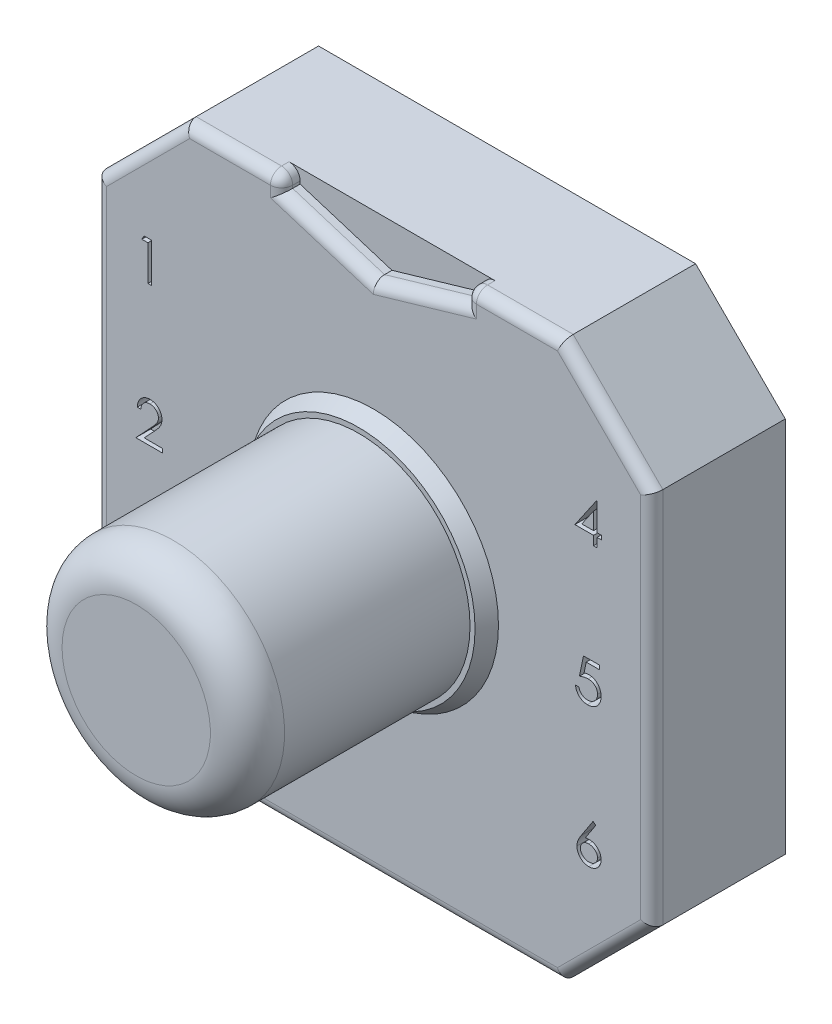
from build123d import *

# Parameters (mm, degrees)
BOSS_EXTRU_1_DEPTH      = 1.8
ESQUISSE3_R             = 1.5
BOSS_EXTRU_2_DEPTH      = 5
CONG_2_R                = 0.5
ENL_V_MAT_EXTRU_1_DEPTH = 0.25
CONG_5_R                = 0.15
CONG_6_R                = 0.15
ESQUISSE5_R             = 1.683272336
BOSS_EXTRU_3_DEPTH      = 0.2
BOSS_EXTRU_3_TAPER      = 30
ENL_V_MAT_EXTRU_2_DEPTH = 0.2
ENL_V_MAT_EXTRU_3_DEPTH = 0.2


with BuildPart() as part:
    # Esquisse2 → Boss.-Extru.1 (new body)
    with BuildSketch(Plane.XY):
        Polygon((0, 6.292463408), (1.207536592, 7.5), (6.29082397, 7.5), (7.5, 6.292463408), (7.5, 1.20917603), (6.29082397, 0), (1.207536592, 0), (0, 1.207536592), align=None)
    extrude(amount=BOSS_EXTRU_1_DEPTH)

    # Esquisse3 → Boss.-Extru.2 (add)
    with BuildSketch(Plane(origin=(0, 0, 0), x_dir=(-1, 0, 0), z_dir=(0, 0, -1))):
        with Locations((-3.75, 3.75)):
            Circle(ESQUISSE3_R)
    extrude(amount=-BOSS_EXTRU_2_DEPTH)

    # Congé2
    cong_2_edges = [part.edges().sort_by_distance(p)[0] for p in [
        (5.25, 3.75, 5),
    ]]
    fillet(cong_2_edges, radius=CONG_2_R)

    # Esquisse4 → Enlèv. mat.-Extru.1 (cut)
    with BuildSketch(Plane.XY.offset(1.8)):
        Polygon((2.509231496, 7.5), (4.986114264, 7.5), (4.986114264, 7.287964625), (3.74767288, 6.926039951), (2.509231496, 7.313239286), align=None)
    extrude(amount=-ENL_V_MAT_EXTRU_1_DEPTH, mode=Mode.SUBTRACT)

    # Congé5
    cong_5_edges = [part.edges().sort_by_distance(p)[0] for p in [
        (2.509231496, 7.406619643, 1.8),
        (3.128452188, 7.119639618, 1.8),
        (4.366893572, 7.107002288, 1.8),
        (4.986114264, 7.393982313, 1.8),
    ]]
    fillet(cong_5_edges, radius=CONG_5_R)

    # Congé6
    cong_6_edges = [part.edges().sort_by_distance(p)[0] for p in [
        (3.749180281, 0, 1.8),
        (6.895411985, 0.604588015, 1.8),
        (7.5, 3.750819719, 1.8),
        (6.895411985, 6.896231704, 1.8),
        (5.713469117, 7.5, 1.8),
        (0.603768296, 6.896231704, 1.8),
        (2.509231496, 7.5, 1.6),
        (4.986114264, 7.5, 1.6),
        (0, 3.75, 1.8),
        (1.783384044, 7.5, 1.8),
        (2.465297513, 7.5, 1.756066017),
        (5.030048247, 7.5, 1.756066017),
        (0.603768296, 0.603768296, 1.8),
    ]]
    fillet(cong_6_edges, radius=CONG_6_R)

    # Esquisse5 → Boss.-Extru.3 (add)
    with BuildSketch(Plane.XY.offset(1.8)):
        with Locations((3.75, 3.75)):
            Circle(ESQUISSE5_R)
    extrude(amount=BOSS_EXTRU_3_DEPTH, taper=BOSS_EXTRU_3_TAPER)

    # Esquisse6 → Enlèv. mat.-Extru.2 (cut)
    with BuildSketch(Plane.XY.offset(1.8)):
        Polygon((0.656405419, 5.906707006), (0.754246131, 5.906707006), (0.754246131, 5.377540339), (0.706756815, 5.377540339), (0.706756815, 5.852433501), (0.625346559, 5.852433501), align=None)
        with BuildLine():
            Line((0.611778183, 3.861942048), (0.564288866, 3.861942048))
            add(Edge.make_bspline(
                [(0.564288866, 3.861942048), (0.564598376, 3.86824229), (0.565206246, 3.880615796), (0.568052904, 3.898656434), (0.572126108, 3.915900434), (0.577885173, 3.932209337), (0.585037432, 3.947727347), (0.593614472, 3.962392826), (0.603773542, 3.976149827), (0.615295274, 3.988870819), (0.627809104, 4.000540845), (0.641311312, 4.010618482), (0.655499786, 4.019133178), (0.670331481, 4.026251413), (0.685973733, 4.031594462), (0.702284593, 4.035558924), (0.719335725, 4.037944157), (0.730953204, 4.038200544), (0.736861649, 4.038330937)],
                knots=[0, 0, 0, 0, 1.10065271, 2.161652631, 3.183658789, 4.190468796, 5.17591951, 6.163126047, 7.15150782, 8.156236427, 9.156009102, 10.134482811, 11.092018607, 12.041330605, 13.001268258, 13.972401359, 14.968799086, 16, 16, 16, 16], degree=3))
            add(Edge.make_bspline(
                [(0.736861649, 4.038330937), (0.742664049, 4.038195099), (0.754065556, 4.037928182), (0.770705884, 4.035635979), (0.786547214, 4.032045872), (0.801558578, 4.027008898), (0.815620209, 4.020237919), (0.828837741, 4.012104244), (0.84136853, 4.002697198), (0.852648366, 3.991621919), (0.863006135, 3.979798463), (0.871941833, 3.967175887), (0.879594061, 3.95413884), (0.885972436, 3.94058791), (0.890667829, 3.926395504), (0.894232629, 3.911768249), (0.896247607, 3.896554736), (0.896556856, 3.886257673), (0.89671408, 3.881022577)],
                knots=[0, 0, 0, 0, 1.111607364, 2.184268762, 3.212621178, 4.221274766, 5.211760367, 6.196651075, 7.1921475, 8.207485113, 9.220403448, 10.201281604, 11.166441695, 12.114753415, 13.065576456, 14.026450734, 14.996634279, 16, 16, 16, 16], degree=3))
            add(Edge.make_bspline(
                [(0.89671408, 3.881022577), (0.896458075, 3.873652369), (0.895950557, 3.859041289), (0.891609217, 3.837569994), (0.884828851, 3.81676718), (0.876664965, 3.800024754), (0.86842925, 3.7865335), (0.861007687, 3.775425731), (0.852319555, 3.763465738), (0.842238401, 3.750693569), (0.830972764, 3.737009182), (0.818420604, 3.722420844), (0.804492411, 3.707079279), (0.794716661, 3.696600932), (0.789651113, 3.691171315)],
                knots=[0, 0, 0, 0, 1.184426356, 2.348067706, 3.509069118, 4.696110526, 5.333549288, 6.050745305, 6.844228056, 7.710549037, 8.667450064, 9.695053472, 10.805634456, 12, 12, 12, 12], degree=3))
            Line((0.789651113, 3.691171315), (0.657253443, 3.549869399))
            Line((0.657253443, 3.549869399), (0.903498268, 3.549869399))
            Line((0.903498268, 3.549869399), (0.903498268, 3.495595895))
            Line((0.903498268, 3.495595895), (0.543936302, 3.495595895))
            Line((0.543936302, 3.495595895), (0.74915799, 3.714597965))
            add(Edge.make_bspline(
                [(0.74915799, 3.714597965), (0.754154516, 3.71981378), (0.763751819, 3.729832294), (0.77732609, 3.744458908), (0.789517937, 3.758028184), (0.800406281, 3.770514483), (0.809754918, 3.782100447), (0.818051077, 3.792410836), (0.824698256, 3.801898712), (0.831912369, 3.8128964), (0.838899483, 3.826323976), (0.844903613, 3.842733236), (0.848564667, 3.859625333), (0.849003851, 3.871040522), (0.849224764, 3.87678246)],
                knots=[0, 0, 0, 0, 1.329631726, 2.553950428, 3.673215718, 4.687767853, 5.603093632, 6.413772471, 7.123043292, 7.734684054, 8.834405432, 9.900288307, 10.943827018, 12, 12, 12, 12], degree=3))
            add(Edge.make_bspline(
                [(0.849224764, 3.87678246), (0.849128646, 3.8803931), (0.848939215, 3.887508978), (0.847267397, 3.897941991), (0.844740927, 3.908005957), (0.841120632, 3.917731832), (0.836341994, 3.927021829), (0.830525185, 3.935887258), (0.823813831, 3.944458089), (0.816050008, 3.952494362), (0.807521123, 3.959854497), (0.79851104, 3.966374448), (0.788978465, 3.971823218), (0.778963589, 3.976289913), (0.768494334, 3.97979381), (0.75755045, 3.982221714), (0.746162176, 3.98374609), (0.738385921, 3.98395234), (0.734423582, 3.984057433)],
                knots=[0, 0, 0, 0, 0.991446411, 1.95395049, 2.89581595, 3.838931463, 4.798493298, 5.75982156, 6.748411868, 7.785213223, 8.824556874, 9.840280684, 10.836137867, 11.835679398, 12.848801643, 13.863922112, 14.911575587, 16, 16, 16, 16], degree=3))
            add(Edge.make_bspline(
                [(0.734423582, 3.984057433), (0.730285373, 3.983949327), (0.722158613, 3.983737024), (0.710226807, 3.982251931), (0.698844314, 3.979689882), (0.687982503, 3.976185789), (0.677622994, 3.971731937), (0.667816168, 3.966184495), (0.658584041, 3.959564848), (0.649909257, 3.952059668), (0.641916727, 3.943703733), (0.634894402, 3.934388894), (0.628758485, 3.924285225), (0.623404946, 3.913419989), (0.61905736, 3.901694596), (0.615735229, 3.88915067), (0.613106503, 3.875842675), (0.61222831, 3.866652549), (0.611778183, 3.861942048)],
                knots=[0, 0, 0, 0, 1.031018746, 2.02475058, 2.990194455, 3.934040569, 4.864654155, 5.795059489, 6.735614925, 7.690564532, 8.649604399, 9.611025574, 10.590972636, 11.591080095, 12.624614302, 13.701020113, 14.821632451, 16, 16, 16, 16], degree=3))
        make_face()
        with BuildLine():
            Line((0.611778183, 2.020702732), (0.564288866, 2.020702732))
            add(Edge.make_bspline(
                [(0.564288866, 2.020702732), (0.565575429, 2.026029548), (0.568090555, 2.036443038), (0.573336497, 2.051321278), (0.579051385, 2.065400668), (0.585913785, 2.078417574), (0.593399037, 2.090633599), (0.601974973, 2.101771669), (0.611245931, 2.112115058), (0.621500417, 2.121294321), (0.632254393, 2.12960643), (0.643659389, 2.136693492), (0.655485946, 2.14279012), (0.667816003, 2.147812703), (0.680686269, 2.151596324), (0.693980391, 2.15434146), (0.707733206, 2.156124164), (0.717068853, 2.156298148), (0.721809232, 2.156386493)],
                knots=[0, 0, 0, 0, 1.162005537, 2.271625781, 3.343758855, 4.383309926, 5.390229558, 6.379919256, 7.361854164, 8.333198761, 9.295911338, 10.242430842, 11.177959212, 12.116337295, 13.062827104, 14.020064771, 14.994644689, 16, 16, 16, 16], degree=3))
            add(Edge.make_bspline(
                [(0.721809232, 2.156386493), (0.728716028, 2.156177966), (0.742378962, 2.155765462), (0.76245147, 2.151998636), (0.781807906, 2.146037932), (0.800236399, 2.137802023), (0.817353948, 2.127643941), (0.8325843, 2.115554035), (0.845721015, 2.101765569), (0.856741951, 2.086535764), (0.865371147, 2.070259277), (0.871734206, 2.053507348), (0.87560796, 2.036319717), (0.876109997, 2.024714747), (0.876361516, 2.018900682)],
                knots=[0, 0, 0, 0, 1.083050992, 2.142477498, 3.193116406, 4.255571735, 5.30263384, 6.308962982, 7.297363603, 8.282367274, 9.249857812, 10.179914175, 11.08814088, 12, 12, 12, 12], degree=3))
            add(Edge.make_bspline(
                [(0.876361516, 2.018900682), (0.876185592, 2.013305607), (0.875841336, 2.002356914), (0.872918264, 1.98637283), (0.867999091, 1.971307969), (0.861184972, 1.957098913), (0.852364285, 1.943835752), (0.841679247, 1.931488648), (0.82905444, 1.920002834), (0.819487267, 1.913423105), (0.814561803, 1.910035665)],
                knots=[0, 0, 0, 0, 1.024540389, 2.004866551, 2.965041327, 3.920577974, 4.882998113, 5.874504559, 6.905732034, 8, 8, 8, 8], degree=3))
            add(Edge.make_bspline(
                [(0.814561803, 1.910035665), (0.82019089, 1.907317537), (0.831343739, 1.901932138), (0.846546021, 1.891370613), (0.860346366, 1.879176141), (0.868042524, 1.869659812), (0.871909392, 1.864878413)],
                knots=[0, 0, 0, 0, 1.015518401, 2.012035669, 3.001164323, 4, 4, 4, 4], degree=3))
            add(Edge.make_bspline(
                [(0.871909392, 1.864878413), (0.874455643, 1.861392301), (0.879506448, 1.854477163), (0.885740868, 1.843359156), (0.891396769, 1.832117919), (0.895804005, 1.820452152), (0.899216959, 1.808497065), (0.901656573, 1.796232131), (0.903172128, 1.783647335), (0.903389169, 1.775133425), (0.903498268, 1.770853807)],
                knots=[0, 0, 0, 0, 1.025084078, 2.033381695, 3.024893161, 4.013698104, 4.991890475, 5.976764909, 6.982997093, 8, 8, 8, 8], degree=3))
            add(Edge.make_bspline(
                [(0.903498268, 1.770853807), (0.903226955, 1.763444004), (0.902685605, 1.748659269), (0.897846894, 1.726816067), (0.890345844, 1.705464116), (0.879693426, 1.685042086), (0.866711077, 1.665934576), (0.851265862, 1.648838515), (0.833533274, 1.634143012), (0.813756706, 1.621864799), (0.792330426, 1.612049828), (0.76941364, 1.605237571), (0.745336548, 1.600800736), (0.728825445, 1.600324959), (0.720431194, 1.600083074)],
                knots=[0, 0, 0, 0, 0.955779014, 1.907060117, 2.875433937, 3.871313158, 4.872415639, 5.851225146, 6.836215519, 7.83643374, 8.849228613, 9.86973379, 10.916971861, 12, 12, 12, 12], degree=3))
            add(Edge.make_bspline(
                [(0.720431194, 1.600083074), (0.714773752, 1.60021434), (0.703641793, 1.600472627), (0.687276407, 1.60223832), (0.67165515, 1.605463213), (0.656756902, 1.60980288), (0.642568426, 1.615304965), (0.629133019, 1.62215672), (0.616368024, 1.630216912), (0.604393896, 1.63958068), (0.593212065, 1.650055359), (0.583119689, 1.6618269), (0.573948506, 1.674677698), (0.565944083, 1.688757017), (0.55874183, 1.703882907), (0.552818042, 1.720249049), (0.547604153, 1.737709133), (0.545180046, 1.749876601), (0.543936302, 1.756119399)],
                knots=[0, 0, 0, 0, 1.048658725, 2.063410685, 3.046034179, 4.001477787, 4.936774919, 5.862367409, 6.792675028, 7.730719943, 8.675894397, 9.627829632, 10.600096036, 11.597688215, 12.626045268, 13.701542398, 14.82072376, 16, 16, 16, 16], degree=3))
            Line((0.543936302, 1.756119399), (0.591425618, 1.756119399))
            add(Edge.make_bspline(
                [(0.591425618, 1.756119399), (0.592662854, 1.752044965), (0.595069385, 1.744119836), (0.599165785, 1.732713981), (0.603832774, 1.722257942), (0.60883938, 1.712675017), (0.614097549, 1.703870833), (0.619981115, 1.696078193), (0.626054308, 1.688954823), (0.630632258, 1.68494153), (0.632872767, 1.682977372)],
                knots=[0, 0, 0, 0, 1.198163088, 2.33053128, 3.407730985, 4.417276592, 5.372219308, 6.28897303, 7.162600585, 8, 8, 8, 8], degree=3))
            add(Edge.make_bspline(
                [(0.632872767, 1.682977372), (0.635835583, 1.680693135), (0.641752069, 1.676131714), (0.651393218, 1.670310634), (0.66153279, 1.665266765), (0.672390485, 1.661413873), (0.683732004, 1.658151536), (0.695740665, 1.656016648), (0.708310523, 1.654551889), (0.716893268, 1.654422631), (0.721279218, 1.654356578)],
                knots=[0, 0, 0, 0, 0.946170439, 1.889420265, 2.845303464, 3.807233317, 4.801018734, 5.828864929, 6.890507805, 8, 8, 8, 8], degree=3))
            add(Edge.make_bspline(
                [(0.721279218, 1.654356578), (0.726231235, 1.654449697), (0.735914478, 1.654631784), (0.750043963, 1.656306325), (0.763485922, 1.65874509), (0.776091115, 1.662511696), (0.788024656, 1.667165467), (0.799119262, 1.673008738), (0.809520578, 1.679864428), (0.819095381, 1.687656658), (0.827705, 1.696187051), (0.835285616, 1.705109265), (0.841730059, 1.714385682), (0.846928529, 1.724067636), (0.851033434, 1.734115034), (0.853827917, 1.744556071), (0.855770944, 1.755305301), (0.855929182, 1.76261218), (0.856008952, 1.766295681)],
                knots=[0, 0, 0, 0, 1.217147791, 2.380027433, 3.494444702, 4.572153297, 5.609568379, 6.639424714, 7.649109417, 8.668170816, 9.669597737, 10.625200337, 11.543417969, 12.441394052, 13.322311151, 14.205496177, 15.095365482, 16, 16, 16, 16], degree=3))
            add(Edge.make_bspline(
                [(0.856008952, 1.766295681), (0.855777585, 1.771226205), (0.855316002, 1.781062719), (0.851791967, 1.795534304), (0.845995496, 1.809477606), (0.837880723, 1.822654732), (0.828002583, 1.834867279), (0.816456937, 1.8457638), (0.803147907, 1.854755112), (0.790898474, 1.860967325), (0.780048266, 1.865206264), (0.770762845, 1.868029741), (0.760367501, 1.870420615), (0.748987946, 1.87264497), (0.736538436, 1.874538079), (0.723032524, 1.876116782), (0.708467475, 1.877379984), (0.698384406, 1.877944091), (0.693188439, 1.878234783)],
                knots=[0, 0, 0, 0, 1.07054697, 2.135767047, 3.216561865, 4.33974944, 5.486079747, 6.621378074, 7.775625952, 8.963672916, 9.598146892, 10.304877434, 11.070270905, 11.915000392, 12.823868403, 13.805723172, 14.86925407, 16, 16, 16, 16], degree=3))
            Line((0.693188439, 1.878234783), (0.693188439, 1.932508288))
            add(Edge.make_bspline(
                [(0.693188439, 1.932508288), (0.699735163, 1.932619383), (0.712558587, 1.932836991), (0.731290226, 1.935468917), (0.749202262, 1.939109678), (0.765897734, 1.944686368), (0.781114861, 1.951163413), (0.794316753, 1.958700592), (0.805318453, 1.967078775), (0.814066496, 1.976427276), (0.8206477, 1.98645348), (0.825459609, 1.99690326), (0.828302039, 2.007868208), (0.828681477, 2.01535133), (0.8288722, 2.019112688)],
                knots=[0, 0, 0, 0, 1.321986639, 2.589447074, 3.816329219, 5.01088745, 6.139805852, 7.153945165, 8.075214402, 8.924034688, 9.728124013, 10.488707548, 11.240355623, 12, 12, 12, 12], degree=3))
            add(Edge.make_bspline(
                [(0.8288722, 2.019112688), (0.828809545, 2.021876109), (0.828684896, 2.027373804), (0.827112926, 2.035405809), (0.82475072, 2.043192261), (0.821503189, 2.050700049), (0.817156433, 2.057877102), (0.811954576, 2.06478461), (0.805760589, 2.071383133), (0.798662885, 2.07753361), (0.7910411, 2.08339515), (0.78268786, 2.088371378), (0.773855029, 2.092626643), (0.764532828, 2.096135699), (0.754691003, 2.098775377), (0.744375798, 2.100670677), (0.733567541, 2.101855656), (0.726193719, 2.102026261), (0.72244525, 2.102112989)],
                knots=[0, 0, 0, 0, 0.884392785, 1.759457502, 2.611959086, 3.489218968, 4.37281399, 5.2945488, 6.255912374, 7.266815255, 8.301784654, 9.332968512, 10.37626691, 11.440494194, 12.520033166, 13.637162961, 14.798855837, 16, 16, 16, 16], degree=3))
            add(Edge.make_bspline(
                [(0.72244525, 2.102112989), (0.716420057, 2.101902628), (0.704651455, 2.101491745), (0.687685628, 2.097892956), (0.671913538, 2.092151031), (0.659857811, 2.08529711), (0.650955327, 2.078531271), (0.644593694, 2.072622386), (0.638346427, 2.066055757), (0.632624521, 2.058426931), (0.62683786, 2.050252547), (0.621569694, 2.041117062), (0.616450431, 2.031258779), (0.61336576, 2.024289558), (0.611778183, 2.020702732)],
                knots=[0, 0, 0, 0, 1.472543308, 2.876219568, 4.221790263, 5.565193594, 6.249813518, 6.953379497, 7.687249741, 8.463570142, 9.283606569, 10.136032583, 11.040678096, 12, 12, 12, 12], degree=3))
        make_face()
    extrude(amount=-ENL_V_MAT_EXTRU_2_DEPTH, mode=Mode.SUBTRACT)

    # Esquisse7 → Enlèv. mat.-Extru.3 (cut)
    # profile 1 of 3: a face of its own
    with BuildSketch(Plane.XY.offset(1.8)):
        Polygon((6.752521022, 5.861095702), (6.762167289, 5.861095702), (6.762167289, 5.494749548), (6.823224981, 5.494749548), (6.823224981, 5.440476044), (6.762167289, 5.440476044), (6.762167289, 5.318360659), (6.714677973, 5.318360659), (6.714677973, 5.440476044), (6.463663016, 5.440476044), align=None)
        Polygon((6.714677973, 5.494749548), (6.714677973, 5.724563918), (6.556945601, 5.494749548), align=None, mode=Mode.SUBTRACT)
    # profile 2 of 3: a face of its own
    with BuildSketch(Plane.XY.offset(1.8)):
        with BuildLine():
            Line((6.796088229, 3.965582882), (6.796088229, 3.911309377))
            Line((6.796088229, 3.911309377), (6.616095241, 3.911309377))
            Line((6.616095241, 3.911309377), (6.58758045, 3.77212752))
            add(Edge.make_bspline(
                [(6.58758045, 3.77212752), (6.593182946, 3.773674239), (6.604036894, 3.776670764), (6.620057016, 3.779997827), (6.635265599, 3.782003436), (6.645134613, 3.782277289), (6.649910178, 3.782409805)],
                knots=[0, 0, 0, 0, 1.100273476, 2.13160584, 3.095893838, 4, 4, 4, 4], degree=3))
            add(Edge.make_bspline(
                [(6.649910178, 3.782409805), (6.655819267, 3.782281907), (6.667438013, 3.782030429), (6.684437711, 3.779615637), (6.700665422, 3.775814722), (6.716087209, 3.770504833), (6.730731602, 3.763714909), (6.744463864, 3.755233133), (6.75749012, 3.745325117), (6.769576679, 3.733933669), (6.780541663, 3.72139671), (6.790182474, 3.707916889), (6.798371342, 3.693625207), (6.804957313, 3.678385115), (6.810216373, 3.6623651), (6.813716734, 3.645396602), (6.816047594, 3.627639565), (6.816308002, 3.615498279), (6.816440793, 3.609307007)],
                knots=[0, 0, 0, 0, 1.052922333, 2.070308379, 3.05430497, 4.020497103, 4.973039431, 5.925935799, 6.892292201, 7.88610001, 8.88166317, 9.857072816, 10.836096531, 11.812156883, 12.81219415, 13.836441305, 14.89672472, 16, 16, 16, 16], degree=3))
            add(Edge.make_bspline(
                [(6.816440793, 3.609307007), (6.81634024, 3.604994719), (6.816140493, 3.596428419), (6.815124707, 3.583706618), (6.81316895, 3.571254142), (6.810543115, 3.55906934), (6.807134916, 3.54717528), (6.803009071, 3.535537918), (6.79795991, 3.524229686), (6.792421595, 3.513143584), (6.78618552, 3.502530238), (6.779264246, 3.492604737), (6.771951844, 3.483218185), (6.764083682, 3.474471251), (6.755586627, 3.466421414), (6.746563585, 3.4590209), (6.737086554, 3.452144556), (6.727008917, 3.446071508), (6.716555232, 3.440483061), (6.705574537, 3.435898431), (6.694316788, 3.431799577), (6.682619956, 3.428532422), (6.670510534, 3.425972381), (6.657968562, 3.4242336), (6.645059818, 3.422967162), (6.636309667, 3.422887885), (6.631889678, 3.422847839)],
                knots=[0, 0, 0, 0, 1.056347294, 2.098418968, 3.122841568, 4.141288669, 5.149314143, 6.15115421, 7.162517403, 8.180376062, 9.185164535, 10.17417709, 11.141909838, 12.097768115, 13.052685741, 14.0056014, 14.954263652, 15.917497458, 16.885230207, 17.854509472, 18.828990115, 19.81800267, 20.826176721, 21.857883937, 22.917946725, 24, 24, 24, 24], degree=3))
            add(Edge.make_bspline(
                [(6.631889678, 3.422847839), (6.626617034, 3.422952287), (6.61624373, 3.423157776), (6.601045978, 3.425307476), (6.586423651, 3.428386306), (6.572494457, 3.433018218), (6.559133563, 3.438822012), (6.546520843, 3.446157195), (6.534334017, 3.454469512), (6.523068507, 3.464278803), (6.512612761, 3.475000579), (6.503253087, 3.486635841), (6.494917415, 3.498992554), (6.487739232, 3.512130728), (6.481616316, 3.526015839), (6.476806193, 3.540699912), (6.472923871, 3.556106222), (6.471281425, 3.566712764), (6.470447204, 3.572099976)],
                knots=[0, 0, 0, 0, 1.0467383, 2.05933395, 3.04377827, 4.011590433, 4.970194871, 5.932262533, 6.905835911, 7.896367577, 8.894135286, 9.877477877, 10.858688626, 11.851381753, 12.8477658, 13.868841284, 14.917554742, 16, 16, 16, 16], degree=3))
            Line((6.470447204, 3.572099976), (6.51793652, 3.572099976))
            add(Edge.make_bspline(
                [(6.51793652, 3.572099976), (6.519105004, 3.567053774), (6.521350896, 3.557354694), (6.526280575, 3.543727693), (6.532307915, 3.531584192), (6.539475001, 3.520763552), (6.548024827, 3.511327906), (6.557781062, 3.502919136), (6.568719349, 3.495333135), (6.58087404, 3.489009931), (6.59369697, 3.483617155), (6.607117726, 3.480026125), (6.620770884, 3.477501109), (6.630005351, 3.477248354), (6.634645755, 3.477121343)],
                knots=[0, 0, 0, 0, 1.136247022, 2.183929868, 3.172523383, 4.106158343, 5.02341133, 5.958108904, 6.928429099, 7.938127109, 8.96079061, 9.975095812, 10.982467395, 12, 12, 12, 12], degree=3))
            add(Edge.make_bspline(
                [(6.634645755, 3.477121343), (6.639175186, 3.477245437), (6.648093674, 3.477489779), (6.661218729, 3.479370439), (6.673890437, 3.482266881), (6.685983764, 3.48660149), (6.69771033, 3.49186968), (6.708773507, 3.498630173), (6.719493347, 3.506410438), (6.729536648, 3.515324119), (6.738734993, 3.525146918), (6.746862407, 3.535651238), (6.75363225, 3.546857), (6.759337287, 3.558570202), (6.763669393, 3.570919222), (6.766759875, 3.583846186), (6.768574623, 3.597383022), (6.768824266, 3.60661612), (6.768951477, 3.611321063)],
                knots=[0, 0, 0, 0, 1.027316725, 2.022795036, 3.002884548, 3.971462791, 4.93288096, 5.914575861, 6.907176829, 7.935150275, 8.956128384, 9.956726525, 10.942570165, 11.921478529, 12.907843606, 13.90538589, 14.932640048, 16, 16, 16, 16], degree=3))
            add(Edge.make_bspline(
                [(6.768951477, 3.611321063), (6.768851921, 3.615565849), (6.768657055, 3.623874414), (6.767064933, 3.636030008), (6.764295581, 3.647531528), (6.760451733, 3.658434513), (6.755571379, 3.668749248), (6.749607472, 3.678486377), (6.742448089, 3.687517564), (6.734269911, 3.695847033), (6.725310659, 3.703534294), (6.715416189, 3.710087507), (6.704793557, 3.715600504), (6.693570748, 3.720358166), (6.681480817, 3.723775183), (6.668763184, 3.726340566), (6.655280515, 3.727824555), (6.646062327, 3.72803046), (6.64132394, 3.7281363)],
                knots=[0, 0, 0, 0, 1.045622112, 2.046656509, 3.013763289, 3.955457236, 4.890082067, 5.820317437, 6.762574623, 7.722996705, 8.69280354, 9.665887285, 10.63943826, 11.638615906, 12.663482002, 13.728887084, 14.832589034, 16, 16, 16, 16], degree=3))
            add(Edge.make_bspline(
                [(6.64132394, 3.7281363), (6.637222304, 3.72804852), (6.628753467, 3.727867277), (6.615762754, 3.726532795), (6.602111505, 3.724379949), (6.587852052, 3.721418695), (6.57294157, 3.717543521), (6.557411526, 3.712899781), (6.541229267, 3.707347764), (6.530325754, 3.703154918), (6.524720708, 3.700999548)],
                knots=[0, 0, 0, 0, 0.817624296, 1.688186739, 2.600797293, 3.572016777, 4.590301741, 5.671205678, 6.80286297, 8, 8, 8, 8], degree=3))
            Line((6.524720708, 3.700999548), (6.578994212, 3.965582882))
            Line((6.578994212, 3.965582882), (6.796088229, 3.965582882))
        make_face()
    # profile 3 of 3: a face of its own
    with BuildSketch(Plane.XY.offset(1.8)):
        with BuildLine():
            Line((6.707893785, 2.097206813), (6.744464799, 2.068480017))
            Line((6.744464799, 2.068480017), (6.604646923, 1.854672091))
            add(Edge.make_bspline(
                [(6.604646923, 1.854672091), (6.613955763, 1.856155853), (6.632113707, 1.859050099), (6.650493313, 1.859527551), (6.659450442, 1.859760232)],
                knots=[0, 0, 0, 0, 1.025318673, 2, 2, 2, 2], degree=3))
            add(Edge.make_bspline(
                [(6.659450442, 1.859760232), (6.664828665, 1.859615677), (6.675415536, 1.859331125), (6.690958946, 1.857141305), (6.705894892, 1.853690365), (6.720161469, 1.848659917), (6.733809884, 1.842233966), (6.746918461, 1.834532493), (6.759240788, 1.825157825), (6.77093555, 1.814685624), (6.781553218, 1.803086746), (6.790953646, 1.790779639), (6.798849839, 1.777777125), (6.805256373, 1.764085789), (6.810231277, 1.749726737), (6.81385798, 1.73471834), (6.8160018, 1.719050248), (6.816292916, 1.708394619), (6.816440793, 1.702981887)],
                knots=[0, 0, 0, 0, 1.04369286, 2.054478336, 3.041073146, 4.015093852, 4.984733326, 5.965804835, 6.960378782, 7.985147595, 9.009457201, 10.008161701, 10.986880575, 11.956520048, 12.937015923, 13.931873656, 14.949455224, 16, 16, 16, 16], degree=3))
            add(Edge.make_bspline(
                [(6.816440793, 1.702981887), (6.816225634, 1.695576622), (6.81580225, 1.681004813), (6.811583462, 1.659781192), (6.805027896, 1.63956211), (6.795657484, 1.62067038), (6.784018481, 1.603131896), (6.769825083, 1.587591713), (6.753580651, 1.573732076), (6.735213004, 1.562142325), (6.715445913, 1.55267734), (6.694679599, 1.545879024), (6.673115733, 1.541693547), (6.658479798, 1.541168825), (6.65107621, 1.540903394)],
                knots=[0, 0, 0, 0, 1.031375318, 2.029502543, 3.004789286, 3.987476834, 4.960371455, 5.9300674, 6.912260825, 7.929083631, 8.949397511, 9.960523116, 10.96833055, 12, 12, 12, 12], degree=3))
            add(Edge.make_bspline(
                [(6.65107621, 1.540903394), (6.643955638, 1.541134445), (6.62985103, 1.541592114), (6.609102738, 1.545669107), (6.589166306, 1.552277205), (6.570181412, 1.561381031), (6.552594843, 1.572880258), (6.53686111, 1.586723603), (6.523058663, 1.602615153), (6.511572024, 1.620552443), (6.502461477, 1.639827711), (6.495629191, 1.659926543), (6.49163833, 1.680775707), (6.491080656, 1.694909165), (6.490799768, 1.70202786)],
                knots=[0, 0, 0, 0, 1.012016664, 2.004627821, 2.994792927, 3.992885782, 4.990978636, 5.973936114, 6.964471063, 7.975201453, 8.993600317, 9.990122807, 10.98767138, 12, 12, 12, 12], degree=3))
            add(Edge.make_bspline(
                [(6.490799768, 1.70202786), (6.490978391, 1.707477458), (6.491343106, 1.718604495), (6.493889666, 1.735456795), (6.497981605, 1.752700232), (6.502564226, 1.767328545), (6.507406193, 1.779312132), (6.511435803, 1.788973731), (6.516451395, 1.798916179), (6.521799514, 1.809480407), (6.527961564, 1.820394157), (6.534661668, 1.831839831), (6.542085068, 1.843635399), (6.547289069, 1.851640057), (6.549949407, 1.85573212)],
                knots=[0, 0, 0, 0, 1.173818275, 2.396712641, 3.66331629, 4.989737886, 5.693666774, 6.447286557, 7.243889047, 8.091586357, 8.998013824, 9.943181721, 10.948533338, 12, 12, 12, 12], degree=3))
            Line((6.549949407, 1.85573212), (6.707893785, 2.097206813))
        make_face()
        with BuildLine():
            add(Edge.make_bspline(
                [(6.649486166, 1.805486728), (6.645455089, 1.805369095), (6.637581223, 1.805139324), (6.62602915, 1.80380503), (6.615096075, 1.801292385), (6.604637151, 1.798092238), (6.594847915, 1.793692132), (6.585657221, 1.788347277), (6.577029529, 1.782054551), (6.569055206, 1.774903104), (6.561825329, 1.767073246), (6.555599134, 1.758686783), (6.550228485, 1.749945826), (6.545861829, 1.740777342), (6.542461544, 1.731184835), (6.54000194, 1.721212425), (6.538633099, 1.710793238), (6.538405371, 1.703727729), (6.538289084, 1.700119807)],
                knots=[0, 0, 0, 0, 1.129588631, 2.206414736, 3.251139165, 4.268635594, 5.265702196, 6.250456724, 7.242448911, 8.251968645, 9.246821453, 10.222880186, 11.173611482, 12.116736599, 13.062300278, 14.020270554, 14.989073742, 16, 16, 16, 16], degree=3))
            add(Edge.make_bspline(
                [(6.538289084, 1.700119807), (6.538383784, 1.696544156), (6.538569476, 1.689532835), (6.540255601, 1.679200602), (6.542831143, 1.669257574), (6.54666237, 1.659755011), (6.551232387, 1.650548067), (6.557265692, 1.641970233), (6.563950849, 1.633500532), (6.57194186, 1.625789595), (6.580517893, 1.618614605), (6.589680217, 1.612343186), (6.599229402, 1.606978014), (6.609294367, 1.602773241), (6.619732313, 1.599322427), (6.630630206, 1.596894084), (6.641995626, 1.595521195), (6.649694538, 1.59529317), (6.653620281, 1.595176899)],
                knots=[0, 0, 0, 0, 0.989467248, 1.94019797, 2.891935182, 3.827694429, 4.772920941, 5.730924762, 6.725747692, 7.756678648, 8.79901574, 9.819492441, 10.826891316, 11.826466727, 12.835195252, 13.867842842, 14.912794438, 16, 16, 16, 16], degree=3))
            add(Edge.make_bspline(
                [(6.653620281, 1.595176899), (6.657546017, 1.595293179), (6.665244916, 1.595521222), (6.676610427, 1.596893981), (6.687507983, 1.599322803), (6.697947157, 1.602771877), (6.708007588, 1.606983077), (6.717548421, 1.612309808), (6.726624097, 1.618653173), (6.735205759, 1.625777333), (6.743163509, 1.633544419), (6.750009002, 1.641894627), (6.755857539, 1.650617395), (6.760610089, 1.659718742), (6.764399117, 1.66926332), (6.76698772, 1.679199062), (6.768670362, 1.689533238), (6.768856533, 1.696544292), (6.768951477, 1.700119807)],
                knots=[0, 0, 0, 0, 1.087397944, 2.132534446, 3.165364764, 4.174271784, 5.174024072, 6.181601208, 7.194203697, 8.236725232, 9.267838612, 10.269026844, 11.221737037, 12.171628256, 13.107553087, 14.05945871, 15.010357665, 16, 16, 16, 16], degree=3))
            add(Edge.make_bspline(
                [(6.768951477, 1.700119807), (6.768868278, 1.703732436), (6.768704985, 1.710822851), (6.76685805, 1.721207764), (6.764296525, 1.731235504), (6.760428614, 1.740843046), (6.755403565, 1.749992478), (6.74928286, 1.758730018), (6.742202221, 1.767122654), (6.734023188, 1.774918459), (6.725119546, 1.782046648), (6.715652666, 1.788339129), (6.705748484, 1.793649691), (6.695417043, 1.798080646), (6.684539964, 1.801278245), (6.673292853, 1.803796056), (6.66153186, 1.805135909), (6.65355254, 1.805368299), (6.649486166, 1.805486728)],
                knots=[0, 0, 0, 0, 0.978206639, 1.919901502, 2.851605144, 3.780102724, 4.718870031, 5.675451981, 6.667674623, 7.690630536, 8.733308323, 9.756129687, 10.767539656, 11.776269907, 12.797430371, 13.836405707, 14.897401972, 16, 16, 16, 16], degree=3))
        make_face(mode=Mode.SUBTRACT)
    extrude(amount=-ENL_V_MAT_EXTRU_3_DEPTH, mode=Mode.SUBTRACT)


solid = part.part
